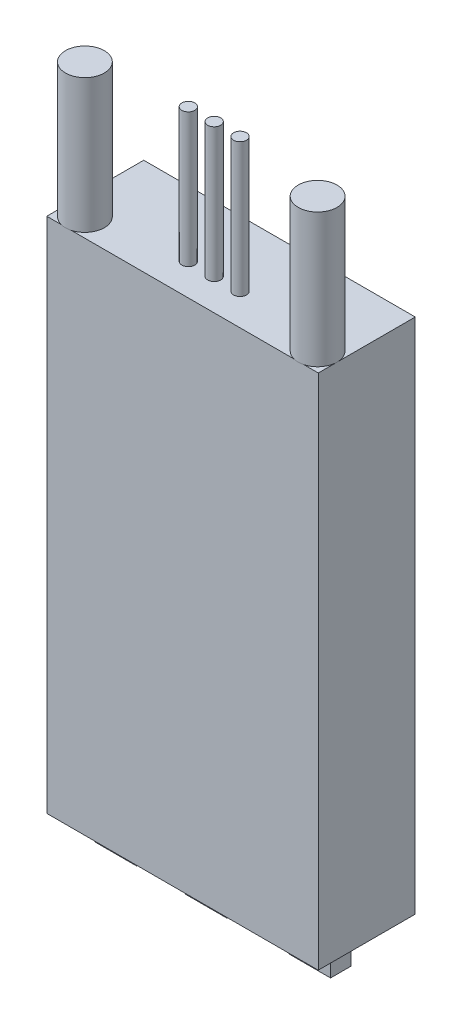
from build123d import *

# Parameters (mm, degrees)
SKETCH1_W           = 40
SKETCH1_H           = 21
BOSS_EXTRUDE1_DEPTH = 3.75
SKETCH2_W           = 3
SKETCH2_H           = 3.2
BOSS_EXTRUDE2_DEPTH = 0.8
SKETCH3_R           = 1.5
SKETCH3_R_2         = 0.5
BOSS_EXTRUDE3_DEPTH = 10.366683148


with BuildPart() as part:
    # Sketch1 → Boss-Extrude1 (new, symmetric)
    with BuildSketch(Plane(origin=(0, 0, 0), x_dir=(0, 1, 0), z_dir=(0, 0, 1))):
        Rectangle(SKETCH1_W, SKETCH1_H)
    extrude(amount=BOSS_EXTRUDE1_DEPTH, both=True)

    # Sketch2 → Boss-Extrude2 (add, symmetric)
    with BuildSketch(Plane(origin=(0, 0, 0), x_dir=(0, 1, 0), z_dir=(0, 0, 1))):
        with Locations((-21.5, 8.1)):
            Rectangle(SKETCH2_W, SKETCH2_H)
        with Locations((-21.5, 1.1)):
            Rectangle(SKETCH2_W, SKETCH2_H)
        with Locations((-21.5, -6.9)):
            Rectangle(SKETCH2_W, SKETCH2_H)
    extrude(amount=BOSS_EXTRUDE2_DEPTH, both=True)

    # Sketch3 → Boss-Extrude3 (add)
    with BuildSketch(Plane(origin=(0, 20, 0), x_dir=(-1, 0, 0), z_dir=(0, 1, 0))):
        with Locations(Location((-9, 2.3, 0), (0, 0, 180))):
            Circle(SKETCH3_R)
        with Locations((9, 2.3)):
            Circle(SKETCH3_R)
        with Locations((0, 1.3)):
            Circle(SKETCH3_R_2)
        with Locations((2, 1.3)):
            Circle(SKETCH3_R_2)
        with Locations((-2, 1.3)):
            Circle(SKETCH3_R_2)
    extrude(amount=BOSS_EXTRUDE3_DEPTH)


solid = part.part
